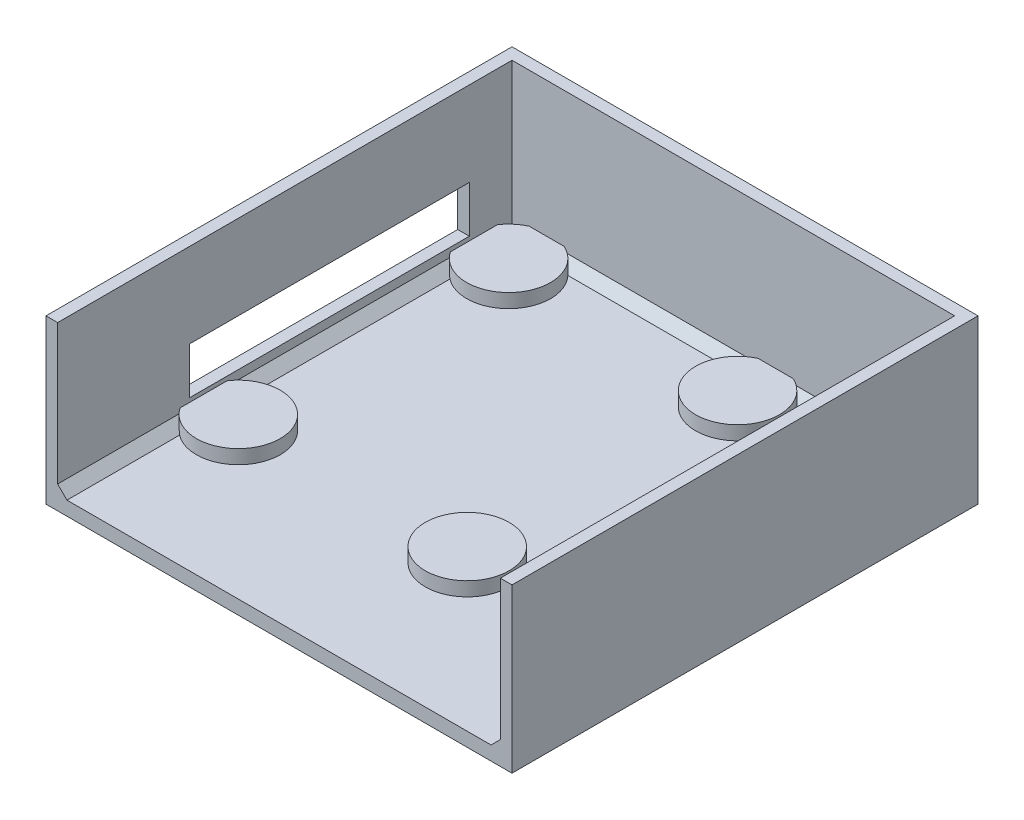
from build123d import *

# Parameters (mm, degrees)
SKETCH_1_W          = 100
SKETCH_1_H          = 100
EXTRUDE_1_DEPTH     = 3
EXTRUDE_2_DEPTH     = 32
SKETCH_3_R          = 9
EXTRUDE_3_DEPTH     = 3
SKETCH_4_W          = 60
SKETCH_4_H          = 10
CUT_EXTRUDE_1_DEPTH = 2.5
CHAMFER_1_SIZE      = 2


with BuildPart() as part:
    # Эскиз1 → Бобышка-Вытянуть1 (new body)
    with BuildSketch(Plane(origin=(0, 0, 0), x_dir=(1, 0, 0), z_dir=(0, 1, 0))):
        with Locations((-19.913614773, -13.668080108)):
            Rectangle(SKETCH_1_W, SKETCH_1_H)
    extrude(amount=EXTRUDE_1_DEPTH)

    # Эскиз2 → Бобышка-Вытянуть2 (add)
    with BuildSketch(Plane(origin=(0, 3, 0), x_dir=(1, 0, 0), z_dir=(0, 1, 0))):
        Polygon((27.586385227, -61.041825342), (27.586385227, -63.668080108), (30.086385227, -63.668080108), (30.086385227, 36.331919892), (-69.913614773, 36.331919892), (-69.913614773, -63.668080108), (-67.413614773, -63.668080108), (-67.413614773, -61.041825342), (-67.413614773, 33.831919892), (27.586385227, 33.831919892), align=None)
    extrude(amount=EXTRUDE_2_DEPTH)

    # Эскиз3 → Бобышка-Вытянуть3 (add)
    with BuildSketch(Plane(origin=(0, 3, 0), x_dir=(1, 0, 0), z_dir=(0, 1, 0))):
        with Locations((-10.839314865, 25.657938065)):
            Circle(SKETCH_3_R)
        with Locations((-59.962592759, 25.657938065)):
            Circle(SKETCH_3_R)
        with Locations((-59.962592759, -32.348529185)):
            Circle(SKETCH_3_R)
        with Locations(Location((-10.839314865, -32.348529185, 0), (0, 0, 270))):
            Circle(SKETCH_3_R)
    extrude(amount=EXTRUDE_3_DEPTH)

    # Эскиз4 → Вырез-Вытянуть1 (cut)
    with BuildSketch(Plane.ZY.offset(69.913614773)):
        with Locations((5.326629647, 11.873940314)):
            Rectangle(SKETCH_4_W, SKETCH_4_H)
    extrude(amount=-CUT_EXTRUDE_1_DEPTH, mode=Mode.SUBTRACT)

    # Фаска1
    chamfer_1_edges = [part.edges().sort_by_distance(p)[0] for p in [
        (-67.413614773, 3, 50.53230301),
        (27.586385227, 3, 14.918080108),
        (10.256751916, 3, -33.831919892),
        (-35.400953812, 3, -33.831919892),
        (-67.413614773, 3, 3.34529556),
    ]]
    chamfer(chamfer_1_edges, length=CHAMFER_1_SIZE)


solid = part.part
